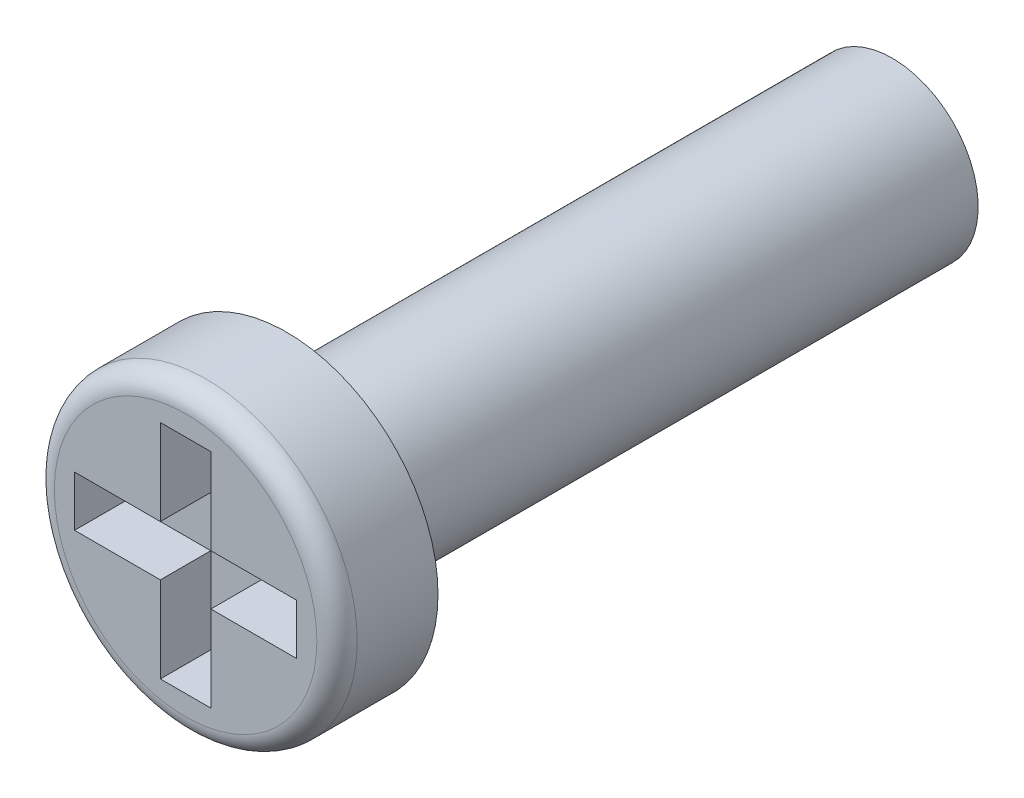
from build123d import *

# Parameters (mm, degrees)
SKETCH1_R           = 1.5
BOSS_EXTRUDE1_DEPTH = 1
SKETCH2_R           = 0.85
BOSS_EXTRUDE2_DEPTH = 6
CUT_EXTRUDE1_DEPTH  = 0.5
FILLET1_R           = 0.2


with BuildPart() as part:
    # Sketch1 → Boss-Extrude1 (new body)
    with BuildSketch(Plane.XY):
        Circle(SKETCH1_R)
    extrude(amount=BOSS_EXTRUDE1_DEPTH)

    # Sketch2 → Boss-Extrude2 (add)
    with BuildSketch(Plane(origin=(0, 0, 0), x_dir=(-1, 0, 0), z_dir=(0, 0, -1))):
        Circle(SKETCH2_R)
    extrude(amount=BOSS_EXTRUDE2_DEPTH)

    # Sketch3 → Cut-Extrude1 (cut)
    with BuildSketch(Plane.XY.offset(1)):
        Polygon((-0.25, 1.1), (-0.25, 0.25), (-1.1, 0.25), (-1.1, -0.25), (-0.25, -0.25), (-0.25, -1.1), (0.25, -1.1), (0.25, -0.25), (1.1, -0.25), (1.1, 0.25), (0.25, 0.25), (0.25, 1.1), align=None)
    extrude(amount=-CUT_EXTRUDE1_DEPTH, mode=Mode.SUBTRACT)

    # Fillet1
    fillet1_edges = [part.edges().sort_by_distance(p)[0] for p in [
        (-1.5, 0, 1),
    ]]
    fillet(fillet1_edges, radius=FILLET1_R)


solid = part.part
